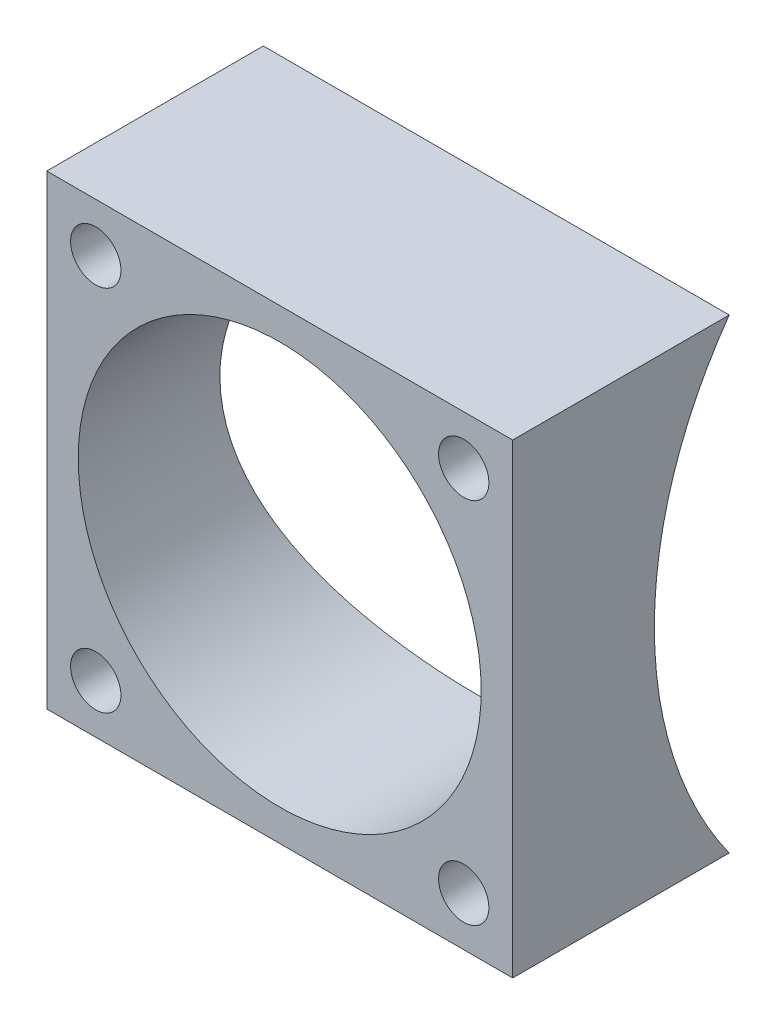
from build123d import *

# Parameters (mm, degrees)
SKETCH1_W               = 37
SKETCH1_H               = 37
BOSS_EXTRUDE1_DEPTH     = 43
CUT_EXTRUDE1_DEPTH      = 20
CUT_EXTRUDE1_DEPTH_BACK = 20
SKETCH2_R               = 31.75
SKETCH5_R               = 16
CUT_EXTRUDE2_DEPTH      = 51.333885207
SKETCH6_R               = 2
CUT_EXTRUDE3_DEPTH      = 32.30854563


with BuildPart() as part:
    # Sketch1 → Boss-Extrude1 (new body)
    with BuildSketch(Plane.XY):
        Rectangle(SKETCH1_W, SKETCH1_H)
    extrude(amount=BOSS_EXTRUDE1_DEPTH)

    # Sketch2 → Cut-Extrude1 (cut, two sides: drawn at the far end of the back side and taken through both)
    with BuildSketch(Plane(origin=(0, 0, 0), x_dir=(0, 0, -1), z_dir=(1, 0, 0)).offset(-CUT_EXTRUDE1_DEPTH_BACK)):
        Circle(SKETCH2_R)
    extrude(amount=CUT_EXTRUDE1_DEPTH + CUT_EXTRUDE1_DEPTH_BACK, mode=Mode.SUBTRACT)

    # Sketch5 → Cut-Extrude2 (cut, through all)
    with BuildSketch(Plane.XY):
        with Locations(Location((0, 0, 0), (0, 0, 180))):
            Circle(SKETCH5_R)
    extrude(amount=CUT_EXTRUDE2_DEPTH, mode=Mode.SUBTRACT)

    # Sketch6 → Cut-Extrude3 (cut, through all)
    with BuildSketch(Plane.XY.offset(43)):
        with Locations((-14.610912703, -14.610912703)):
            Circle(SKETCH6_R)
        with Locations((14.610912703, -14.610912703)):
            Circle(SKETCH6_R)
        with Locations((14.610912703, 14.610912703)):
            Circle(SKETCH6_R)
        with Locations((-14.610912703, 14.610912703)):
            Circle(SKETCH6_R)
    extrude(amount=-CUT_EXTRUDE3_DEPTH, mode=Mode.SUBTRACT)


solid = part.part
